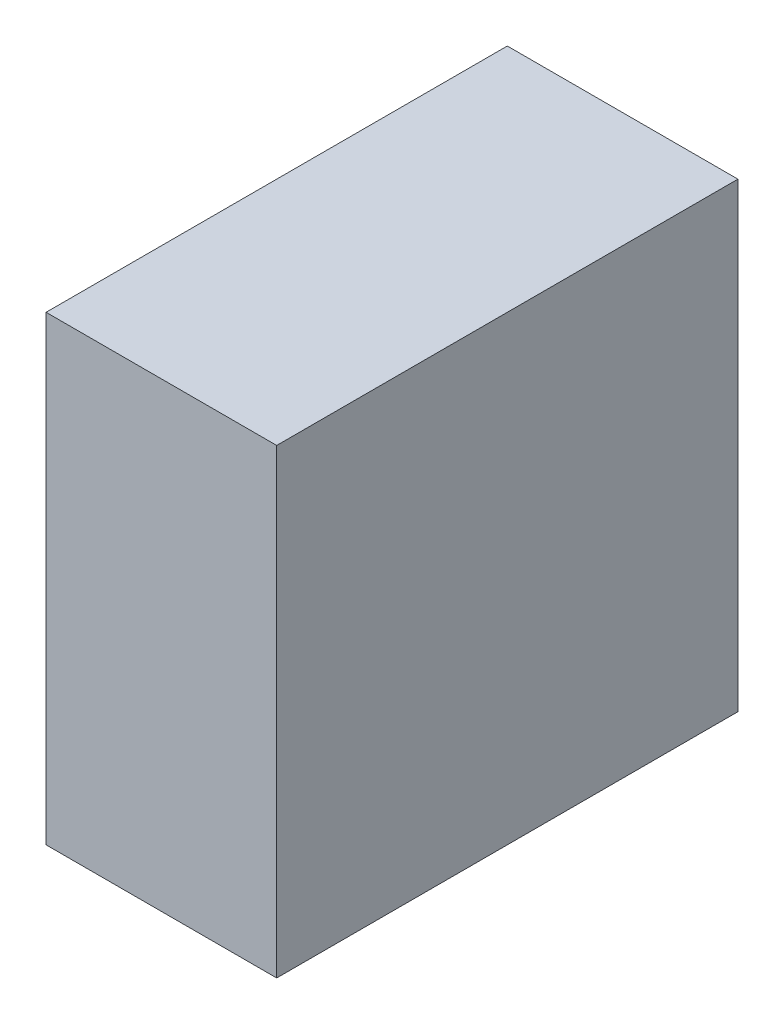
from build123d import *

# Parameters (mm, degrees)
SCHIZZO1_W                   = 100
SCHIZZO1_H                   = 100
ESTRUSIONE_ESTRUSIONE1_DEPTH = 25


with BuildPart() as part:
    # Schizzo1 → Estrusione-Estrusione1 (new, symmetric)
    with BuildSketch(Plane(origin=(0, 0, 0), x_dir=(0, 0, -1), z_dir=(1, 0, 0))):
        Rectangle(SCHIZZO1_W, SCHIZZO1_H)
    extrude(amount=ESTRUSIONE_ESTRUSIONE1_DEPTH, both=True)


solid = part.part
